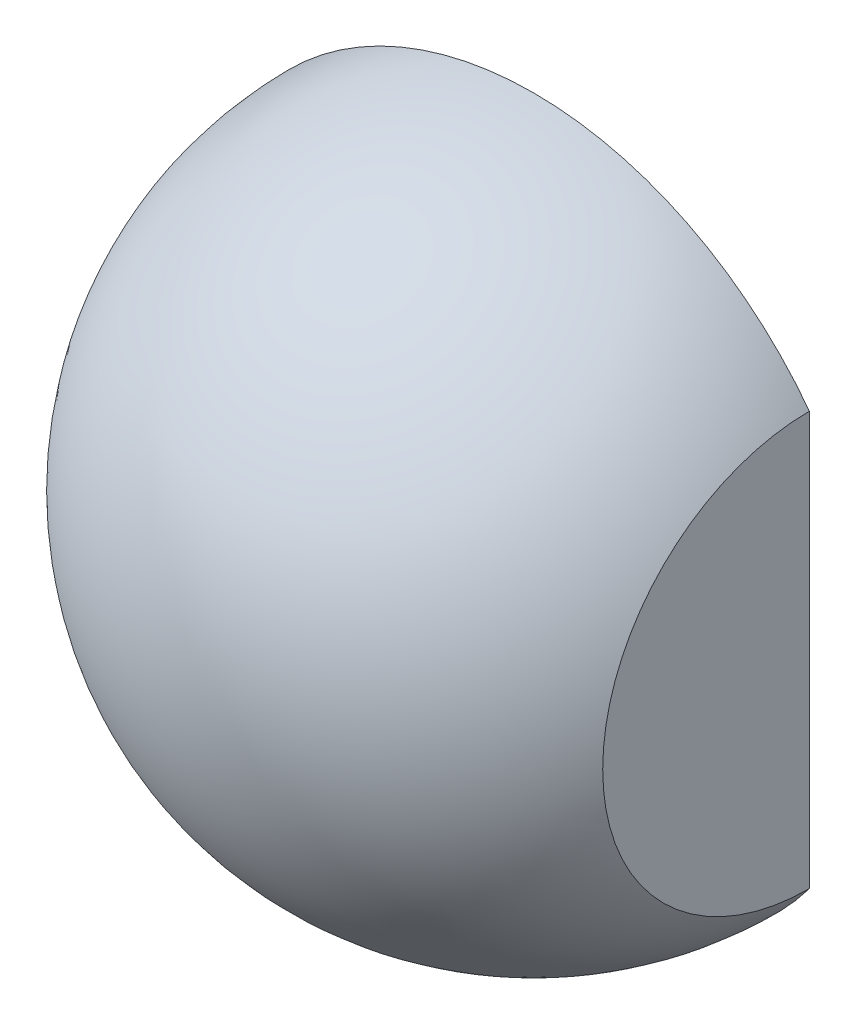
from build123d import *

# Parameters (mm, degrees)
REVOLVE1_ANGLE     = 180
SKETCH3_W          = 56.622410577
SKETCH3_H          = 52.672009839
SKETCH3_W_2        = 24
SKETCH3_H_2        = 38.977287281
CUT_EXTRUDE1_DEPTH = 10
SKETCH4_R          = 2.1
CUT_EXTRUDE2_DEPTH = 8


with BuildPart() as part:
    # Sketch2 → Revolve1 (revolve)
    with BuildSketch(Plane.XY):
        with BuildLine():
            Line((0, 0), (0, 30))
            ThreePointArc((0, 30), (-15, 15), (0, 0))
        make_face()
    revolve(axis=Axis((0, 0, 0), (0, 1, 0)), revolution_arc=REVOLVE1_ANGLE)

    # Sketch3 → Cut-Extrude1 (cut)
    with BuildSketch(Plane(origin=(0, 0, 0), x_dir=(-1, 0, 0), z_dir=(0, 0, -1))):
        with Locations((-0.219466708, 13.463733046)):
            Rectangle(SKETCH3_W, SKETCH3_H)
        with Locations((0, 15.219466708)):
            Rectangle(SKETCH3_W_2, SKETCH3_H_2, mode=Mode.SUBTRACT)
    extrude(amount=-CUT_EXTRUDE1_DEPTH, mode=Mode.SUBTRACT)

    # Sketch4 → Cut-Extrude2 (cut)
    with BuildSketch(Plane(origin=(0, 0, 0), x_dir=(-1, 0, 0), z_dir=(0, 0, -1))):
        with Locations((0, 15)):
            Circle(SKETCH4_R)
    extrude(amount=-CUT_EXTRUDE2_DEPTH, mode=Mode.SUBTRACT)


solid = part.part
